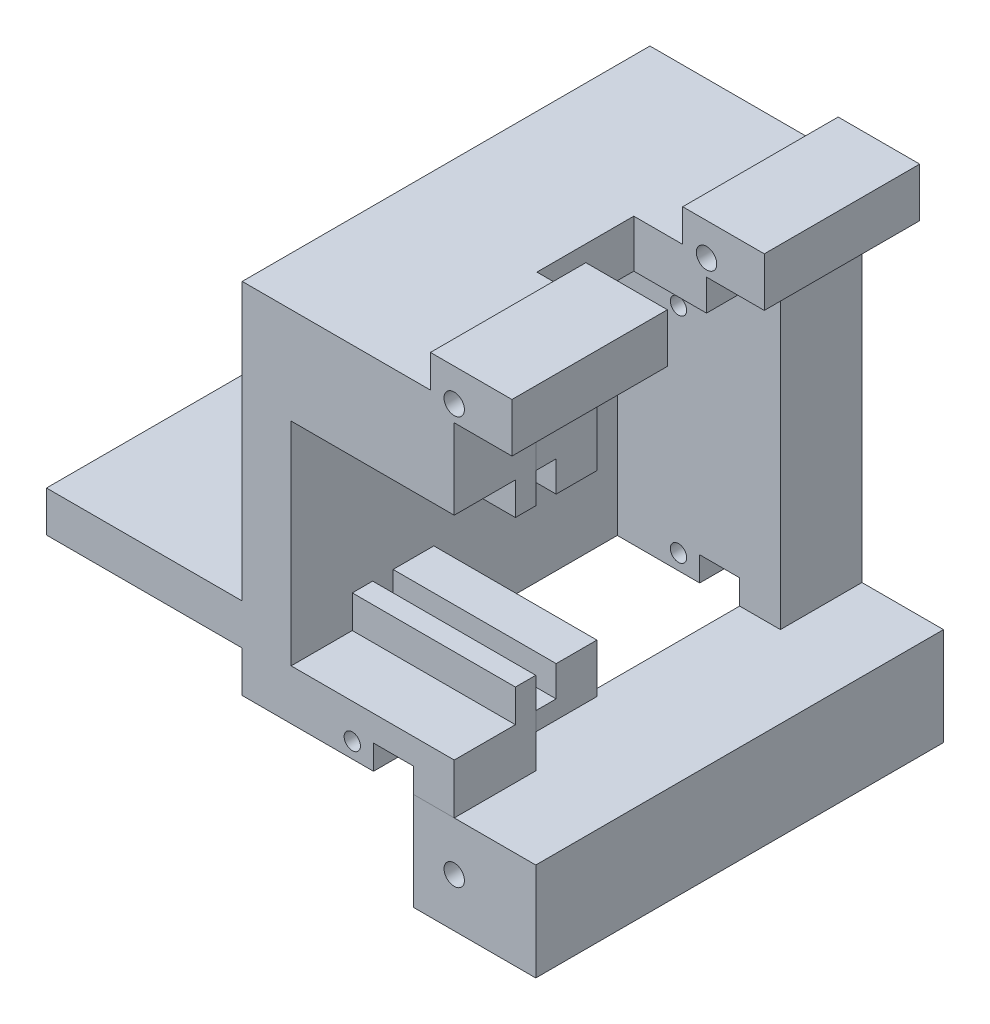
from build123d import *

# Parameters (mm, degrees)
SKETCH8_R                = 1.27
BOSS_EXTRUDE3_DEPTH      = 101.6
SKETCH40_W               = 25.4
SKETCH40_H               = 38.1
CUT_EXTRUDE24_DEPTH      = 50.8
CUT_EXTRUDE11_DEPTH      = 130.327883255
CUT_EXTRUDE11_DEPTH_BACK = 101.6
SKETCH18_W               = 33.02
SKETCH18_H               = 2.3622
BOSS_EXTRUDE4_DEPTH      = 101.6
CUT_EXTRUDE12_START      = -101.6
SKETCH20_R               = 1.5875
CUT_EXTRUDE12_DEPTH      = 101.6
SKETCH21_W               = 33.02
SKETCH21_H               = 19.05
CUT_EXTRUDE13_DEPTH      = 135.416648809
SKETCH24_W               = 8.993546066
SKETCH24_H               = 19.05
CUT_EXTRUDE15_DEPTH      = 135.416648809
SKETCH38_W               = 15.0876
SKETCH38_H               = 7.635884817
CUT_EXTRUDE21_DEPTH      = 20.32
SKETCH41_W               = 30.48
SKETCH41_H               = 19.05
CUT_EXTRUDE25_DEPTH      = 130.137479387
SKETCH43_W               = 12.7
SKETCH43_H               = 33.02
CUT_EXTRUDE26_DEPTH      = 25.4
SKETCH44_W               = 3.175
SKETCH44_H               = 5.08
BOSS_EXTRUDE5_DEPTH      = 25.4
BOSS_EXTRUDE6_DEPTH      = 25.4
BOSS_EXTRUDE6_2_DEPTH    = 25.4
SKETCH46_R               = 1.5875
BOSS_EXTRUDE7_DEPTH      = 63.5
CUT_EXTRUDE29_DEPTH      = 105.670466108
CUT_EXTRUDE29_DEPTH_BACK = 12.7
SKETCH49_W               = 6.223
SKETCH49_H               = 3.81
CUT_EXTRUDE31_DEPTH      = 12.7
SKETCH50_W               = 11.326453934
SKETCH50_H               = 15.0876
CUT_EXTRUDE33_DEPTH      = 4.8768


with BuildPart() as part:
    # Sketch8 → Boss-Extrude3 (new body)
    with BuildSketch(Plane.XY):
        Polygon((0, 0), (0, 48.6918), (-33.02, 48.6918), (-33.02, 5.588), (-63.5, 5.588), (-63.5, -0.762), (-33.02, -0.762), (-33.02, -9.525), (-9.525, -9.525), (0, -9.525), align=None)
        with Locations((-15.875, 28.5877)):
            Circle(SKETCH8_R, mode=Mode.SUBTRACT)
        with Locations((-15.875, -4.7625)):
            Circle(SKETCH8_R, mode=Mode.SUBTRACT)
    extrude(amount=BOSS_EXTRUDE3_DEPTH)

    # Sketch40 → Cut-Extrude24 (cut)
    with BuildSketch(Plane.XZ.offset(9.525)):
        with Locations((-12.7, 50.8)):
            Rectangle(SKETCH40_W, SKETCH40_H)
    extrude(amount=-CUT_EXTRUDE24_DEPTH, mode=Mode.SUBTRACT)

    # Sketch18 → Cut-Extrude11 (cut, two sides: drawn at the far end of the back side and taken through both)
    with BuildSketch(Plane.XY.offset(101.6).offset(-CUT_EXTRUDE11_DEPTH_BACK)):
        with Locations((-16.51, -8.3439)):
            Rectangle(SKETCH18_W, SKETCH18_H)
    extrude(amount=CUT_EXTRUDE11_DEPTH + CUT_EXTRUDE11_DEPTH_BACK, mode=Mode.SUBTRACT)

    # Sketch19 → Boss-Extrude4 (add)
    with BuildSketch(Plane(origin=(0, 0, 0), x_dir=(-1, 0, 0), z_dir=(0, 0, -1))):
        with BuildLine():
            Line((1.5875, 48.6918), (3.706453934, 48.6918))
            Line((3.706453934, 48.6918), (3.706453934, 53.7718))
            Line((3.706453934, 53.7718), (-8.993546066, 53.7718))
            Line((-8.993546066, 53.7718), (-8.993546066, 46.135915183))
            Line((-8.993546066, 46.135915183), (0, 46.135915183))
            Line((0, 46.135915183), (0, 47.1043))
            ThreePointArc((0, 47.1043), (-1.122532015, 49.814332015), (1.5875, 48.6918))
        make_face()
    extrude(amount=-BOSS_EXTRUDE4_DEPTH)

    # Sketch20 → Cut-Extrude12 (cut)
    with BuildSketch(Plane.XY.offset(101.6).offset(CUT_EXTRUDE12_START)):
        with Locations(Location((0, 48.6918, 0), (0, 0, 180))):
            Circle(SKETCH20_R)
    extrude(amount=CUT_EXTRUDE12_DEPTH, mode=Mode.SUBTRACT)

    # Sketch21 → Cut-Extrude13 (cut, through all)
    with BuildSketch(Plane.XZ.offset(7.1628)):
        with Locations((-16.51, 92.075)):
            Rectangle(SKETCH21_W, SKETCH21_H)
        with Locations((-16.51, 9.525)):
            Rectangle(SKETCH21_W, SKETCH21_H)
    extrude(amount=-CUT_EXTRUDE13_DEPTH, mode=Mode.SUBTRACT)

    # Sketch24 → Cut-Extrude15 (cut, through all)
    with BuildSketch(Plane(origin=(0, 53.7718, 0), x_dir=(1, 0, 0), z_dir=(0, 1, 0))):
        with Locations((4.496773033, -92.075)):
            Rectangle(SKETCH24_W, SKETCH24_H)
        with Locations((4.496773033, -9.525)):
            Rectangle(SKETCH24_W, SKETCH24_H)
    extrude(amount=-CUT_EXTRUDE15_DEPTH, mode=Mode.SUBTRACT)

    # Sketch38 → Cut-Extrude21 (cut)
    with BuildSketch(Plane(origin=(8.993546066, 0, 0), x_dir=(0, 0, -1), z_dir=(1, 0, 0))):
        with Locations((-50.8, 49.953857592)):
            Rectangle(SKETCH38_W, SKETCH38_H)
    extrude(amount=-CUT_EXTRUDE21_DEPTH, mode=Mode.SUBTRACT)

    # Sketch41 → Cut-Extrude25 (cut, through all)
    with BuildSketch(Plane(origin=(0, 5.588, 0), x_dir=(1, 0, 0), z_dir=(0, 1, 0))):
        with Locations((-48.26, -9.525)):
            Rectangle(SKETCH41_W, SKETCH41_H)
        with Locations((-48.26, -92.075)):
            Rectangle(SKETCH41_W, SKETCH41_H)
    extrude(amount=-CUT_EXTRUDE25_DEPTH, mode=Mode.SUBTRACT)

    # Sketch43 → Cut-Extrude26 (cut)
    with BuildSketch(Plane(origin=(0, 0, 0), x_dir=(0, 0, -1), z_dir=(1, 0, 0))):
        with Locations((-76.2, 17.1577)):
            Rectangle(SKETCH43_W, SKETCH43_H)
    extrude(amount=-CUT_EXTRUDE26_DEPTH, mode=Mode.SUBTRACT)

    # Sketch44 → Boss-Extrude5 (add)
    with BuildSketch(Plane(origin=(-25.4, 0, 0), x_dir=(0, 0, -1), z_dir=(1, 0, 0))):
        with Locations((-71.4375, 31.1277)):
            Rectangle(SKETCH44_W, SKETCH44_H)
        with Locations((-71.4375, 3.1877)):
            Rectangle(SKETCH44_W, SKETCH44_H)
    extrude(amount=BOSS_EXTRUDE5_DEPTH)

    # Sketch48 → Cut-Extrude29 (cut, two sides: drawn at the far end of the back side and taken through both)
    with BuildSketch(Plane.XY.offset(82.55).offset(-CUT_EXTRUDE29_DEPTH_BACK)):
        Polygon((-12.573, -184.245390082), (-12.573, -7.1628), (-12.573, -3.346799078), (-6.35, -3.346799078), (-6.35, -7.1628), (-6.35, -184.245390082), (-6.35, -538.410570247), (-12.573, -538.410570247), align=None)
    extrude(amount=CUT_EXTRUDE29_DEPTH + CUT_EXTRUDE29_DEPTH_BACK, mode=Mode.SUBTRACT)

    # Sketch49 → Cut-Extrude31 (cut)
    with BuildSketch(Plane(origin=(0, 0, 19.05), x_dir=(-1, 0, 0), z_dir=(0, 0, -1))):
        with Locations((9.4615, -5.2578)):
            Rectangle(SKETCH49_W, SKETCH49_H)
    extrude(amount=-CUT_EXTRUDE31_DEPTH, mode=Mode.SUBTRACT)

    # Sketch50 → Cut-Extrude33 (cut)
    with BuildSketch(Plane(origin=(0, 46.135915183, 0), x_dir=(1, 0, 0), z_dir=(0, 1, 0))):
        with Locations((-5.663226967, -50.8)):
            Rectangle(SKETCH50_W, SKETCH50_H)
    extrude(amount=-CUT_EXTRUDE33_DEPTH, mode=Mode.SUBTRACT)


with BuildPart() as body_2:
    # Sketch45 → Boss-Extrude6 (new body)
    with BuildSketch(Plane(origin=(-25.4, 0, 0), x_dir=(0, 0, -1), z_dir=(1, 0, 0))):
        Polygon((-60.325, -1.905), (-60.325, 5.715), (-66.675, 5.715), (-66.675, 0.9525), (-69.85, 0.9525), (-69.85, -1.905), align=None)
    extrude(amount=BOSS_EXTRUDE6_DEPTH)


with BuildPart() as body_3:
    # Sketch45 → Boss-Extrude6 2 (new body)
    with BuildSketch(Plane(origin=(-25.4, 0, 0), x_dir=(0, 0, -1), z_dir=(1, 0, 0))):
        Polygon((-60.325, 41.275), (-69.85, 41.275), (-69.85, 33.3375), (-66.675, 33.3375), (-66.675, 28.575), (-60.325, 28.575), align=None)
    extrude(amount=BOSS_EXTRUDE6_2_DEPTH)


with BuildPart() as body_4:
    # Sketch46 → Boss-Extrude7 (new body)
    with BuildSketch(Plane.XY.offset(82.55)):
        Polygon((12.7, -7.1628), (0, -7.1628), (-6.35, -7.1628), (-6.35, -22.4028), (12.7, -22.4028), align=None)
        with Locations((0, -14.8082)):
            Circle(SKETCH46_R, mode=Mode.SUBTRACT)
    extrude(amount=-BOSS_EXTRUDE7_DEPTH)


solid = Compound([part.part, body_2.part, body_3.part, body_4.part])
